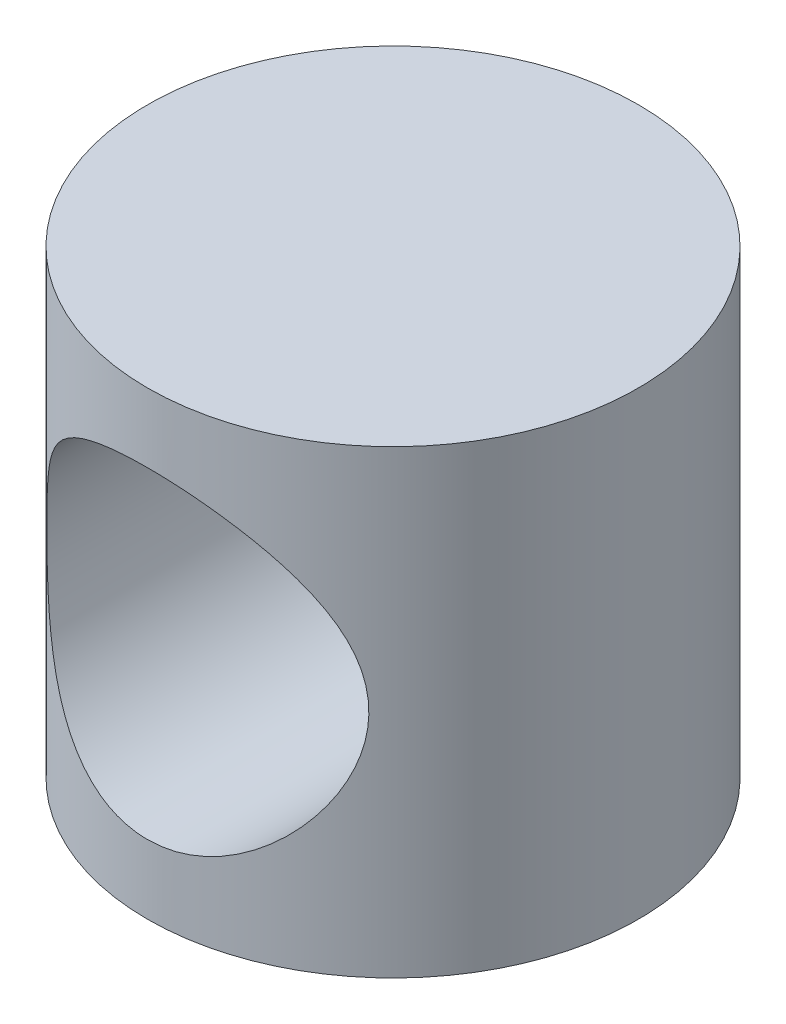
from build123d import *

# Parameters (mm, degrees)
SKETCH1_R               = 3.2
BOSS_EXTRUDE1_DEPTH     = 6
CUT_EXTRUDE1_DEPTH      = 10
CUT_EXTRUDE1_DEPTH_BACK = 10
SKETCH2_R               = 2.1


with BuildPart() as part:
    # Sketch1 → Boss-Extrude1 (new body)
    with BuildSketch(Plane(origin=(0, 0, 0), x_dir=(1, 0, 0), z_dir=(0, 1, 0))):
        Circle(SKETCH1_R)
    extrude(amount=BOSS_EXTRUDE1_DEPTH)

    # Sketch2 → Cut-Extrude1 (cut, two sides: drawn at the far end of the back side and taken through both)
    with BuildSketch(Plane.XY.offset(-CUT_EXTRUDE1_DEPTH_BACK)):
        with Locations((0, 3)):
            Circle(SKETCH2_R)
    extrude(amount=CUT_EXTRUDE1_DEPTH + CUT_EXTRUDE1_DEPTH_BACK, mode=Mode.SUBTRACT)


solid = part.part
